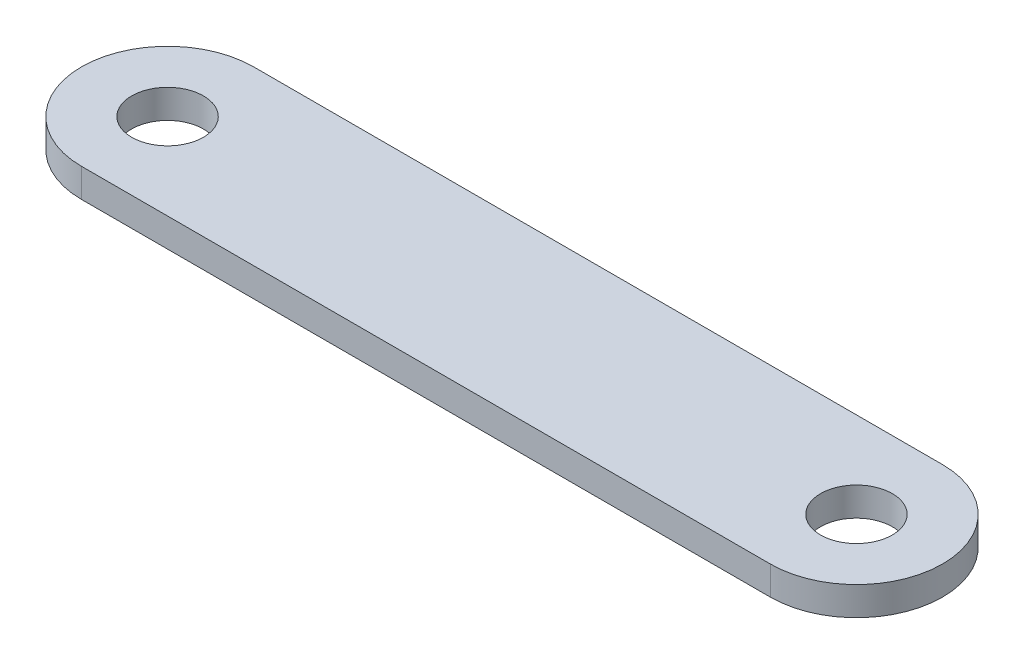
from build123d import *

# Parameters (mm, degrees)
SKETCH1_R           = 3.96875
BOSS_EXTRUDE1_DEPTH = 1.5875


with BuildPart() as part:
    # Sketch1 → Boss-Extrude1 (new, symmetric)
    with BuildSketch(Plane(origin=(0, 0, 0), x_dir=(1, 0, 0), z_dir=(0, 1, 0))):
        with BuildLine():
            Line((-38.1, 9.525), (38.1, 9.525))
            ThreePointArc((38.1, 9.525), (47.625, 0), (38.1, -9.525))
            Line((38.1, -9.525), (-38.1, -9.525))
            ThreePointArc((-38.1, -9.525), (-47.625, 0), (-38.1, 9.525))
        make_face()
        with Locations(Location((-38.1, 0, 0), (0, 0, 270))):
            Circle(SKETCH1_R, mode=Mode.SUBTRACT)
        with Locations(Location((38.1, 0, 0), (0, 0, 270))):
            Circle(SKETCH1_R, mode=Mode.SUBTRACT)
    extrude(amount=BOSS_EXTRUDE1_DEPTH, both=True)


solid = part.part
